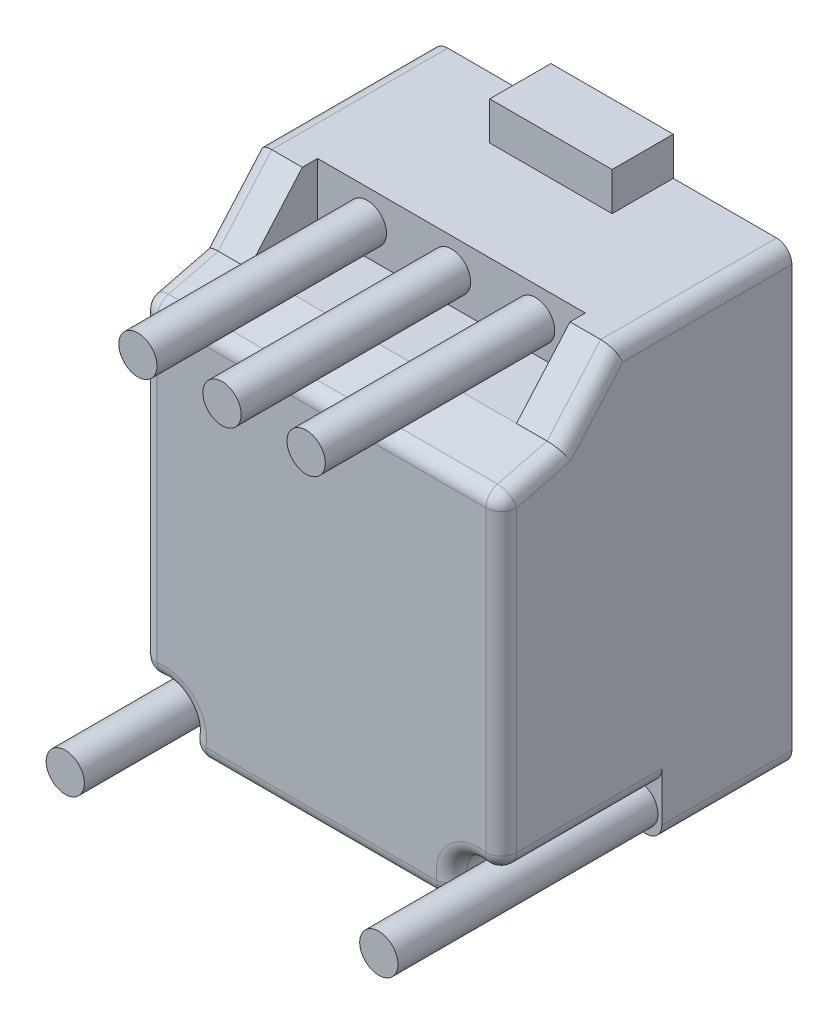
from build123d import *

# Parameters (mm, degrees)
SKETCH_1_W          = 47
SKETCH_1_H          = 59
EXTRUDE_1_DEPTH     = 38
CUT_EXTRUDE_1_DEPTH = 68.25511133
SKETCH_3_W          = 35
SKETCH_3_H          = 8
CUT_EXTRUDE_2_DEPTH = 17
SKETCH_4_R          = 2.5
EXTRUDE_2_DEPTH     = 30
CUT_EXTRUDE_3_DEPTH = 21
SKETCH_6_R          = 2.5
EXTRUDE_3_DEPTH     = 34
FILLET_1_R          = 2
M3X0_51_D           = 2.5
M3X0_51_DEPTH       = 4
M3X0_51_TIP         = 0.751075774
SKETCH_10_R         = 2.5
EXTRUDE_4_DEPTH     = 10
SKETCH_11_W         = 16
SKETCH_11_H         = 8
EXTRUDE_5_DEPTH     = 5


with BuildPart() as part:
    # Эскиз1 → Бобышка-Вытянуть1 (new body)
    with BuildSketch(Plane.XY):
        Rectangle(SKETCH_1_W, SKETCH_1_H)
    extrude(amount=EXTRUDE_1_DEPTH)

    # Эскиз2 → Вырез-Вытянуть1 (cut, through all)
    with BuildSketch(Plane(origin=(23.5, 0, 0), x_dir=(0, 0, -1), z_dir=(1, 0, 0))):
        Polygon((-38, 29.5), (-38, 19.5), (-30, 21.5), (-23, 29.5), align=None)
    extrude(amount=-CUT_EXTRUDE_1_DEPTH, mode=Mode.SUBTRACT)

    # Эскиз3 → Вырез-Вытянуть2 (cut)
    with BuildSketch(Plane.XY.offset(38)):
        with Locations((0, 25.5)):
            Rectangle(SKETCH_3_W, SKETCH_3_H)
    extrude(amount=-CUT_EXTRUDE_2_DEPTH, mode=Mode.SUBTRACT)

    # Эскиз4 → Бобышка-Вытянуть2 (add)
    with BuildSketch(Plane.XY.offset(21)):
        with Locations((0, 25.5)):
            Circle(SKETCH_4_R)
        with Locations((-11, 25.5)):
            Circle(SKETCH_4_R)
        with Locations((11, 25.5)):
            Circle(SKETCH_4_R)
    extrude(amount=EXTRUDE_2_DEPTH)

    # Эскиз5 → Вырез-Вытянуть3 (cut)
    with BuildSketch(Plane.XY.offset(38)):
        with BuildLine():
            Line((-24, -26.5), (-24, -30))
            Line((-24, -30), (-20.5, -30))
            ThreePointArc((-20.5, -30), (-18.025126266, -24.025126266), (-24, -26.5))
        make_face()
        with BuildLine():
            Line((24, -26.5), (24, -30))
            Line((24, -30), (20.5, -30))
            ThreePointArc((20.5, -30), (18.025126266, -24.025126266), (24, -26.5))
        make_face()
    extrude(amount=-CUT_EXTRUDE_3_DEPTH, mode=Mode.SUBTRACT)

    # Эскиз6 → Бобышка-Вытянуть3 (add)
    with BuildSketch(Plane.XY.offset(17)):
        with Locations((-20.5, -26.5)):
            Circle(SKETCH_6_R)
        with Locations((20.5, -26.5)):
            Circle(SKETCH_6_R)
    extrude(amount=EXTRUDE_3_DEPTH)

    # Скругление1
    fillet_1_edges = [part.edges().sort_by_distance(p)[0] for p in [
        (-23.5, -2.598612181, 38),
        (-23.5, 29.5, 11.5),
        (23.5, 29.5, 11.5),
        (-23.5, 25.5, 26.5),
        (-23.5, 20.5, 34),
        (0, 19.5, 38),
        (23.5, 20.5, 34),
        (23.5, 25.5, 26.5),
        (23.5, -2.598612181, 38),
        (18.025126266, -24.025126266, 38),
        (23.5, -29.5, 8.5),
        (23.5, -24.697224362, 27.5),
        (18.697224362, -29.5, 27.5),
        (0, -29.5, 38),
        (-18.025126266, -24.025126266, 38),
        (-23.5, -29.5, 8.5),
        (-23.5, -24.697224362, 27.5),
        (-18.697224362, -29.5, 27.5),
    ]]
    fillet(fillet_1_edges, radius=FILLET_1_R)

    # Отверстие обработанное метчиком M3x0.51
    with Locations(Plane(origin=(0, 0, 0), x_dir=(-1, 0, 0), z_dir=(0, 0, -1))):
        with Locations((-11, 23.5), (11, 23.5), (11, -23.5), (-11, -23.5)):
            Hole(M3X0_51_D / 2, depth=M3X0_51_DEPTH)
            with Locations((0, 0, -(M3X0_51_DEPTH + M3X0_51_TIP / 2))):  # 118° drill point
                Cone(0, M3X0_51_D / 2, M3X0_51_TIP, mode=Mode.SUBTRACT)

    # Эскиз10 → Бобышка-Вытянуть4 (add)
    with BuildSketch(Plane.XZ.offset(29.5)):
        with Locations(Location((0, 5.26015425, 0), (0, 0, 90))):
            Circle(SKETCH_10_R)
    extrude(amount=EXTRUDE_4_DEPTH)

    # Эскиз11 → Бобышка-Вытянуть5 (add)
    with BuildSketch(Plane(origin=(0, 29.5, 0), x_dir=(1, 0, 0), z_dir=(0, 1, 0))):
        with Locations((0, -4)):
            Rectangle(SKETCH_11_W, SKETCH_11_H)
    extrude(amount=EXTRUDE_5_DEPTH)


solid = part.part
